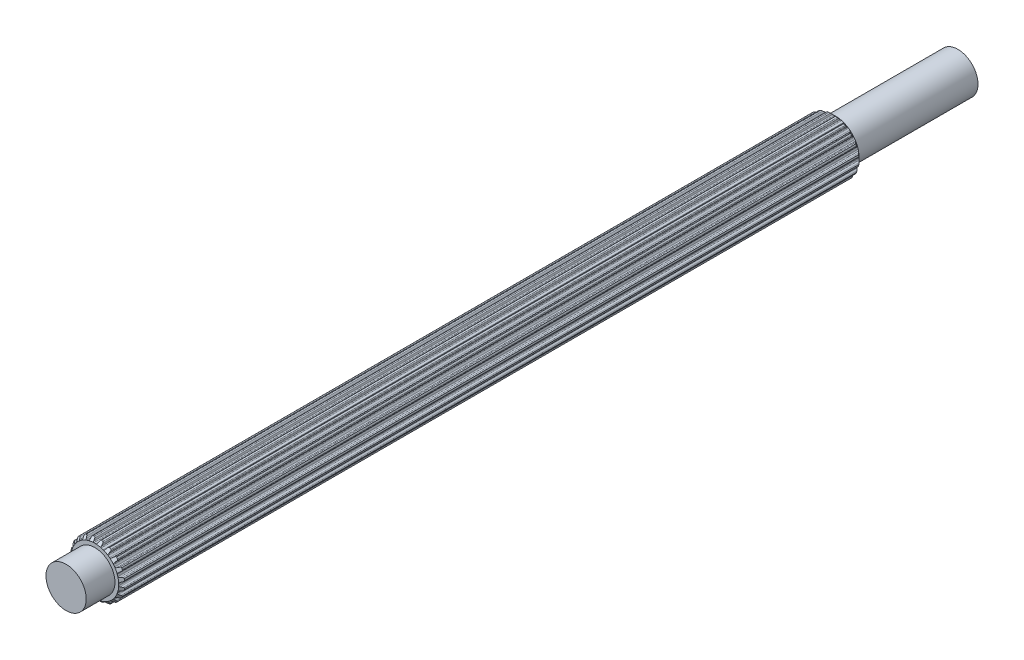
from build123d import *

# Parameters (mm, degrees)
BOSS_EXTRUDE1_DEPTH      = 46.04766
BOSS_EXTRUDE2_DEPTH      = 49.62906
BOSS_EXTRUDE2_DEPTH_BACK = 61.31306
SKETCH2_R                = 2.5019


with BuildPart() as part:
    # Sketch1 → Boss-Extrude1 (new, symmetric)
    with BuildSketch(Plane.XY):
        with BuildLine():
            Line((-0.106949245, 2.969874934), (0.106949245, 2.969874934))
            ThreePointArc((0.106949245, 2.969874934), (0.196343213, 2.986924176), (0.253739238, 3.057547504))
            Line((0.253739238, 3.057547504), (0.315888147, 3.237526941))
            ThreePointArc((0.315888147, 3.237526941), (0.359032156, 3.298322911), (0.4281449, 3.326269005))
            Line((0.4281449, 3.326269005), (0.620027588, 3.2937547))
            ThreePointArc((0.620027588, 3.2937547), (0.689621142, 3.24802576), (0.718272212, 3.169836791))
            Line((0.718272212, 3.169836791), (0.724389167, 2.979527391))
            ThreePointArc((0.724389167, 2.979527391), (0.750934762, 2.9040661), (0.816027049, 2.857568043))
            Line((0.816027049, 2.857568043), (1.019456602, 2.791469774))
            ThreePointArc((1.019456602, 2.791469774), (1.109743823, 2.780060312), (1.186154496, 2.829490741))
            Line((1.186154496, 2.829490741), (1.300878326, 2.981456288))
            ThreePointArc((1.300878326, 2.981456288), (1.360697704, 3.02594446), (1.435063648, 3.031165762))
            Line((1.435063648, 3.031165762), (1.607507455, 2.940947809))
            ThreePointArc((1.607507455, 2.940947809), (1.659563839, 2.875951412), (1.662650905, 2.792735615))
            Line((1.662650905, 2.792735615), (1.609659636, 2.609850378))
            ThreePointArc((1.609659636, 2.609850378), (1.611587176, 2.529879385), (1.659124931, 2.465542482))
            Line((1.659124931, 2.465542482), (1.832172444, 2.339816104))
            ThreePointArc((1.832172444, 2.339816104), (1.914514976, 2.301064775), (2.002460687, 2.32446371))
            Line((2.002460687, 2.32446371), (2.158529469, 2.433539921))
            ThreePointArc((2.158529469, 2.433539921), (2.229168681, 2.457365482), (2.301508367, 2.439350895))
            Line((2.301508367, 2.439350895), (2.437633293, 2.300260456))
            ThreePointArc((2.437633293, 2.300260456), (2.467056864, 2.222358901), (2.444277744, 2.14226202))
            Line((2.444277744, 2.14226202), (2.337365406, 1.984703026))
            ThreePointArc((2.337365406, 1.984703026), (2.314486209, 1.908050449), (2.339816104, 1.832172444))
            Line((2.339816104, 1.832172444), (2.465542482, 1.659124931))
            ThreePointArc((2.465542482, 1.659124931), (2.531880064, 1.596824985), (2.622752074, 1.591901975))
            Line((2.622752074, 1.591901975), (2.804888709, 1.64741171))
            ThreePointArc((2.804888709, 1.64741171), (2.879433095, 1.648242449), (2.942665411, 1.608755366))
            Line((2.942665411, 1.608755366), (3.0291466, 1.434407582))
            ThreePointArc((3.0291466, 1.434407582), (3.033057175, 1.351226417), (2.986641646, 1.282088892))
            Line((2.986641646, 1.282088892), (2.836273564, 1.165279113))
            ThreePointArc((2.836273564, 1.165279113), (2.790827206, 1.099448241), (2.791469774, 1.019456602))
            Line((2.791469774, 1.019456602), (2.857568043, 0.816027049))
            ThreePointArc((2.857568043, 0.816027049), (2.901407091, 0.736276839), (2.986310214, 0.703513784))
            Line((2.986310214, 0.703513784), (3.1766859, 0.700023363))
            ThreePointArc((3.1766859, 0.700023363), (3.247838536, 0.677777961), (3.295773863, 0.620683653))
            Line((3.295773863, 0.620683653), (3.324145932, 0.4281449))
            ThreePointArc((3.324145932, 0.4281449), (3.302160717, 0.347826477), (3.236652255, 0.29641597))
            Line((3.236652255, 0.29641597), (3.057547504, 0.231789562))
            ThreePointArc((3.057547504, 0.231789562), (2.993982591, 0.183224379), (2.969874934, 0.106949245))
            Line((2.969874934, 0.106949245), (2.969874934, -0.106949245))
            ThreePointArc((2.969874934, -0.106949245), (2.986924176, -0.196343213), (3.057547504, -0.253739238))
            Line((3.057547504, -0.253739238), (3.237526941, -0.315888147))
            ThreePointArc((3.237526941, -0.315888147), (3.298322911, -0.359032156), (3.326269005, -0.4281449))
            Line((3.326269005, -0.4281449), (3.2937547, -0.620027588))
            ThreePointArc((3.2937547, -0.620027588), (3.24802576, -0.689621142), (3.169836791, -0.718272212))
            Line((3.169836791, -0.718272212), (2.979527391, -0.724389167))
            ThreePointArc((2.979527391, -0.724389167), (2.9040661, -0.750934762), (2.857568043, -0.816027049))
            Line((2.857568043, -0.816027049), (2.791469774, -1.019456602))
            ThreePointArc((2.791469774, -1.019456602), (2.780060312, -1.109743823), (2.829490741, -1.186154496))
            Line((2.829490741, -1.186154496), (2.981456288, -1.300878326))
            ThreePointArc((2.981456288, -1.300878326), (3.02594446, -1.360697704), (3.031165762, -1.435063648))
            Line((3.031165762, -1.435063648), (2.940947809, -1.607507455))
            ThreePointArc((2.940947809, -1.607507455), (2.875951412, -1.659563839), (2.792735615, -1.662650905))
            Line((2.792735615, -1.662650905), (2.609850378, -1.609659636))
            ThreePointArc((2.609850378, -1.609659636), (2.529879385, -1.611587176), (2.465542482, -1.659124931))
            Line((2.465542482, -1.659124931), (2.339816104, -1.832172444))
            ThreePointArc((2.339816104, -1.832172444), (2.301064775, -1.914514976), (2.32446371, -2.002460687))
            Line((2.32446371, -2.002460687), (2.433539921, -2.158529469))
            ThreePointArc((2.433539921, -2.158529469), (2.457365482, -2.229168681), (2.439350895, -2.301508367))
            Line((2.439350895, -2.301508367), (2.300260456, -2.437633293))
            ThreePointArc((2.300260456, -2.437633293), (2.222358901, -2.467056864), (2.14226202, -2.444277744))
            Line((2.14226202, -2.444277744), (1.984703026, -2.337365406))
            ThreePointArc((1.984703026, -2.337365406), (1.908050449, -2.314486209), (1.832172444, -2.339816104))
            Line((1.832172444, -2.339816104), (1.659124931, -2.465542482))
            ThreePointArc((1.659124931, -2.465542482), (1.596824985, -2.531880064), (1.591901975, -2.622752074))
            Line((1.591901975, -2.622752074), (1.64741171, -2.804888709))
            ThreePointArc((1.64741171, -2.804888709), (1.648242449, -2.879433095), (1.608755366, -2.942665411))
            Line((1.608755366, -2.942665411), (1.434407582, -3.0291466))
            ThreePointArc((1.434407582, -3.0291466), (1.351226417, -3.033057175), (1.282088892, -2.986641646))
            Line((1.282088892, -2.986641646), (1.165279113, -2.836273564))
            ThreePointArc((1.165279113, -2.836273564), (1.099448241, -2.790827206), (1.019456602, -2.791469774))
            Line((1.019456602, -2.791469774), (0.816027049, -2.857568043))
            ThreePointArc((0.816027049, -2.857568043), (0.736276839, -2.901407091), (0.703513784, -2.986310214))
            Line((0.703513784, -2.986310214), (0.700023363, -3.1766859))
            ThreePointArc((0.700023363, -3.1766859), (0.677777961, -3.247838536), (0.620683653, -3.295773863))
            Line((0.620683653, -3.295773863), (0.4281449, -3.324145932))
            ThreePointArc((0.4281449, -3.324145932), (0.347826477, -3.302160717), (0.29641597, -3.236652255))
            Line((0.29641597, -3.236652255), (0.231789562, -3.057547504))
            ThreePointArc((0.231789562, -3.057547504), (0.183224379, -2.993982591), (0.106949245, -2.969874934))
            Line((0.106949245, -2.969874934), (-0.106949245, -2.969874934))
            ThreePointArc((-0.106949245, -2.969874934), (-0.196343213, -2.986924176), (-0.253739238, -3.057547504))
            Line((-0.253739238, -3.057547504), (-0.315888147, -3.237526941))
            ThreePointArc((-0.315888147, -3.237526941), (-0.359032156, -3.298322911), (-0.4281449, -3.326269005))
            Line((-0.4281449, -3.326269005), (-0.620027588, -3.2937547))
            ThreePointArc((-0.620027588, -3.2937547), (-0.689621142, -3.24802576), (-0.718272212, -3.169836791))
            Line((-0.718272212, -3.169836791), (-0.724389167, -2.979527391))
            ThreePointArc((-0.724389167, -2.979527391), (-0.750934762, -2.9040661), (-0.816027049, -2.857568043))
            Line((-0.816027049, -2.857568043), (-1.019456602, -2.791469774))
            ThreePointArc((-1.019456602, -2.791469774), (-1.109743823, -2.780060312), (-1.186154496, -2.829490741))
            Line((-1.186154496, -2.829490741), (-1.300878326, -2.981456288))
            ThreePointArc((-1.300878326, -2.981456288), (-1.360697704, -3.02594446), (-1.435063648, -3.031165762))
            Line((-1.435063648, -3.031165762), (-1.607507455, -2.940947809))
            ThreePointArc((-1.607507455, -2.940947809), (-1.659563839, -2.875951412), (-1.662650905, -2.792735615))
            Line((-1.662650905, -2.792735615), (-1.609659636, -2.609850378))
            ThreePointArc((-1.609659636, -2.609850378), (-1.611587176, -2.529879385), (-1.659124931, -2.465542482))
            Line((-1.659124931, -2.465542482), (-1.832172444, -2.339816104))
            ThreePointArc((-1.832172444, -2.339816104), (-1.914514976, -2.301064775), (-2.002460687, -2.32446371))
            Line((-2.002460687, -2.32446371), (-2.158529469, -2.433539921))
            ThreePointArc((-2.158529469, -2.433539921), (-2.229168681, -2.457365482), (-2.301508367, -2.439350895))
            Line((-2.301508367, -2.439350895), (-2.437633293, -2.300260456))
            ThreePointArc((-2.437633293, -2.300260456), (-2.467056864, -2.222358901), (-2.444277744, -2.14226202))
            Line((-2.444277744, -2.14226202), (-2.337365406, -1.984703026))
            ThreePointArc((-2.337365406, -1.984703026), (-2.314486209, -1.908050449), (-2.339816104, -1.832172444))
            Line((-2.339816104, -1.832172444), (-2.465542482, -1.659124931))
            ThreePointArc((-2.465542482, -1.659124931), (-2.531880064, -1.596824985), (-2.622752074, -1.591901975))
            Line((-2.622752074, -1.591901975), (-2.804888709, -1.64741171))
            ThreePointArc((-2.804888709, -1.64741171), (-2.879433095, -1.648242449), (-2.942665411, -1.608755366))
            Line((-2.942665411, -1.608755366), (-3.0291466, -1.434407582))
            ThreePointArc((-3.0291466, -1.434407582), (-3.033057175, -1.351226417), (-2.986641646, -1.282088892))
            Line((-2.986641646, -1.282088892), (-2.836273564, -1.165279113))
            ThreePointArc((-2.836273564, -1.165279113), (-2.790827206, -1.099448241), (-2.791469774, -1.019456602))
            Line((-2.791469774, -1.019456602), (-2.857568043, -0.816027049))
            ThreePointArc((-2.857568043, -0.816027049), (-2.901407091, -0.736276839), (-2.986310214, -0.703513784))
            Line((-2.986310214, -0.703513784), (-3.1766859, -0.700023363))
            ThreePointArc((-3.1766859, -0.700023363), (-3.247838536, -0.677777961), (-3.295773863, -0.620683653))
            Line((-3.295773863, -0.620683653), (-3.324145932, -0.4281449))
            ThreePointArc((-3.324145932, -0.4281449), (-3.302160717, -0.347826477), (-3.236652255, -0.29641597))
            Line((-3.236652255, -0.29641597), (-3.057547504, -0.231789562))
            ThreePointArc((-3.057547504, -0.231789562), (-2.993982591, -0.183224379), (-2.969874934, -0.106949245))
            Line((-2.969874934, -0.106949245), (-2.969874934, 0.106949245))
            ThreePointArc((-2.969874934, 0.106949245), (-2.986924176, 0.196343213), (-3.057547504, 0.253739238))
            Line((-3.057547504, 0.253739238), (-3.237526941, 0.315888147))
            ThreePointArc((-3.237526941, 0.315888147), (-3.298322911, 0.359032156), (-3.326269005, 0.4281449))
            Line((-3.326269005, 0.4281449), (-3.2937547, 0.620027588))
            ThreePointArc((-3.2937547, 0.620027588), (-3.24802576, 0.689621142), (-3.169836791, 0.718272212))
            Line((-3.169836791, 0.718272212), (-2.979527391, 0.724389167))
            ThreePointArc((-2.979527391, 0.724389167), (-2.9040661, 0.750934762), (-2.857568043, 0.816027049))
            Line((-2.857568043, 0.816027049), (-2.791469774, 1.019456602))
            ThreePointArc((-2.791469774, 1.019456602), (-2.780060312, 1.109743823), (-2.829490741, 1.186154496))
            Line((-2.829490741, 1.186154496), (-2.981456288, 1.300878326))
            ThreePointArc((-2.981456288, 1.300878326), (-3.02594446, 1.360697704), (-3.031165762, 1.435063648))
            Line((-3.031165762, 1.435063648), (-2.940947809, 1.607507455))
            ThreePointArc((-2.940947809, 1.607507455), (-2.875951412, 1.659563839), (-2.792735615, 1.662650905))
            Line((-2.792735615, 1.662650905), (-2.609850378, 1.609659636))
            ThreePointArc((-2.609850378, 1.609659636), (-2.529879385, 1.611587176), (-2.465542482, 1.659124931))
            Line((-2.465542482, 1.659124931), (-2.339816104, 1.832172444))
            ThreePointArc((-2.339816104, 1.832172444), (-2.301064775, 1.914514976), (-2.32446371, 2.002460687))
            Line((-2.32446371, 2.002460687), (-2.433539921, 2.158529469))
            ThreePointArc((-2.433539921, 2.158529469), (-2.457365482, 2.229168681), (-2.439350895, 2.301508367))
            Line((-2.439350895, 2.301508367), (-2.300260456, 2.437633293))
            ThreePointArc((-2.300260456, 2.437633293), (-2.222358901, 2.467056864), (-2.14226202, 2.444277744))
            Line((-2.14226202, 2.444277744), (-1.984703026, 2.337365406))
            ThreePointArc((-1.984703026, 2.337365406), (-1.908050449, 2.314486209), (-1.832172444, 2.339816104))
            Line((-1.832172444, 2.339816104), (-1.659124931, 2.465542482))
            ThreePointArc((-1.659124931, 2.465542482), (-1.596824985, 2.531880064), (-1.591901975, 2.622752074))
            Line((-1.591901975, 2.622752074), (-1.64741171, 2.804888709))
            ThreePointArc((-1.64741171, 2.804888709), (-1.648242449, 2.879433095), (-1.608755366, 2.942665411))
            Line((-1.608755366, 2.942665411), (-1.434407582, 3.0291466))
            ThreePointArc((-1.434407582, 3.0291466), (-1.351226417, 3.033057175), (-1.282088892, 2.986641646))
            Line((-1.282088892, 2.986641646), (-1.165279113, 2.836273564))
            ThreePointArc((-1.165279113, 2.836273564), (-1.099448241, 2.790827206), (-1.019456602, 2.791469774))
            Line((-1.019456602, 2.791469774), (-0.816027049, 2.857568043))
            ThreePointArc((-0.816027049, 2.857568043), (-0.736276839, 2.901407091), (-0.703513784, 2.986310214))
            Line((-0.703513784, 2.986310214), (-0.700023363, 3.1766859))
            ThreePointArc((-0.700023363, 3.1766859), (-0.677777961, 3.247838536), (-0.620683653, 3.295773863))
            Line((-0.620683653, 3.295773863), (-0.4281449, 3.324145932))
            ThreePointArc((-0.4281449, 3.324145932), (-0.347826477, 3.302160717), (-0.29641597, 3.236652255))
            Line((-0.29641597, 3.236652255), (-0.231789562, 3.057547504))
            ThreePointArc((-0.231789562, 3.057547504), (-0.183224379, 2.993982591), (-0.106949245, 2.969874934))
        make_face()
    extrude(amount=BOSS_EXTRUDE1_DEPTH, both=True)

    # Sketch2 → Boss-Extrude2 (add, two sides: drawn at the far end of the back side and taken through both)
    with BuildSketch(Plane.XY.offset(-BOSS_EXTRUDE2_DEPTH_BACK)):
        Circle(SKETCH2_R)
    extrude(amount=BOSS_EXTRUDE2_DEPTH + BOSS_EXTRUDE2_DEPTH_BACK)

    # Sketch3 → Cut-Revolve1 (revolve, cut)
    with BuildSketch(Plane(origin=(0, 0, 0), x_dir=(0, 0, -1), z_dir=(1, 0, 0))):
        Polygon((-44.916435505, 4.101099429), (-46.04766, 2.969874934), (-46.04766, 4.101099429), align=None)
        Polygon((46.04766, 42.761529155), (46.04766, 2.969874934), (26.151832889, 22.865702045), align=None)
    revolve(axis=Axis((0, 0, 14.360793934), (0, 0, -1)), mode=Mode.SUBTRACT)


solid = part.part
